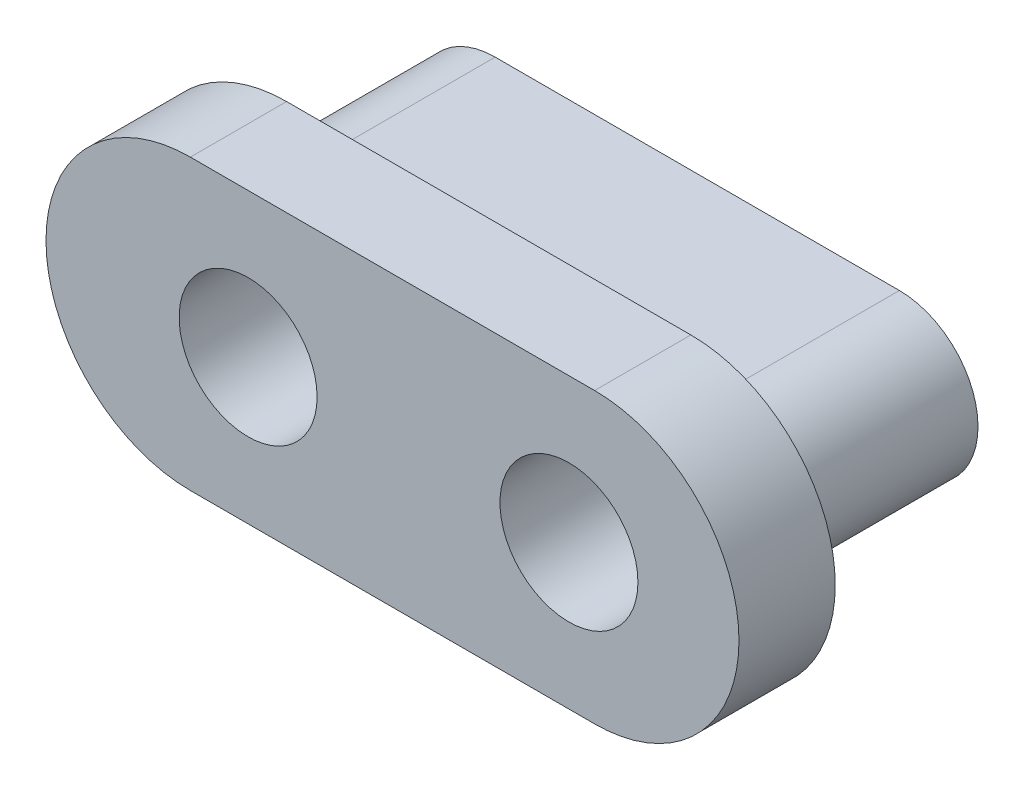
from build123d import *

# Parameters (mm, degrees)
BOSS_EXTRUDE1_DEPTH  = 6.5
BOSS_EXTRUDE2_DEPTH  = 3
M4_CLEARANCE_HOLE1_D = 4.3


with BuildPart() as part:
    # Sketch2 → Boss-Extrude1 (new body)
    with BuildSketch(Plane.XY):
        with BuildLine():
            Line((-49.497947743, 4.45), (-36.897947743, 4.45))
            ThreePointArc((-36.897947743, 4.45), (-34.447947743, 2), (-36.897947743, -0.45))
            Line((-36.897947743, -0.45), (-49.497947743, -0.45))
            ThreePointArc((-49.497947743, -0.45), (-51.947947743, 2), (-49.497947743, 4.45))
        make_face()
    extrude(amount=-BOSS_EXTRUDE1_DEPTH)

    # Sketch3 → Boss-Extrude2 (add)
    with BuildSketch(Plane.XY):
        with BuildLine():
            Line((-49.497947743, 6.5), (-36.897947743, 6.5))
            ThreePointArc((-36.897947743, 6.5), (-32.397947743, 2), (-36.897947743, -2.5))
            Line((-36.897947743, -2.5), (-49.497947743, -2.5))
            ThreePointArc((-49.497947743, -2.5), (-53.997947743, 2), (-49.497947743, 6.5))
        make_face()
    extrude(amount=BOSS_EXTRUDE2_DEPTH)

    # M4 Clearance Hole1 (through all)
    with Locations(Plane(origin=(-47.697947743, 2, 3), x_dir=(1, 0, 0), z_dir=(0, 0, 1))):
        with Locations((0, 0), (10, 0)):
            Hole(M4_CLEARANCE_HOLE1_D / 2)


solid = part.part
